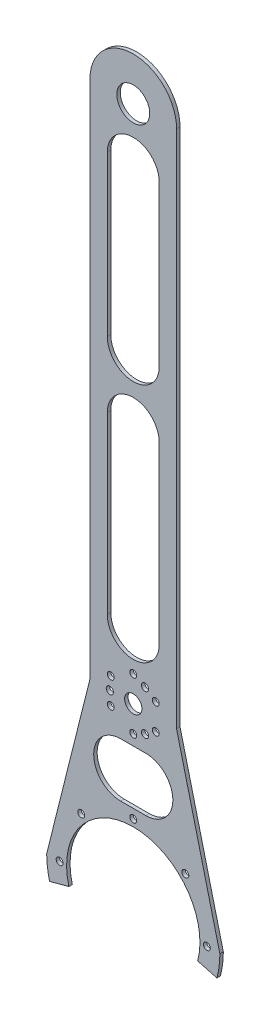
from build123d import *

# Parameters (mm, degrees)
SKETCH_1_R      = 2
SKETCH_1_R_2    = 2.08
SKETCH_1_R_3    = 5
SKETCH_1_R_4    = 9.5
EXTRUDE_1_DEPTH = 2


with BuildPart() as part:
    # 草图1 → 凸台-拉伸1 (new body)
    with BuildSketch(Plane.XY):
        with BuildLine():
            Line((37.188144312, -109.964533236), (48.296291314, -112.940952255))
            ThreePointArc((48.296291314, -112.940952255), (49.572243069, -106.526309611), (50, -100))
            Line((50, -100), (25, 0))
            Line((25, 0), (25, 300))
            ThreePointArc((25, 300), (0, 325), (-25, 300))
            Line((-25, 300), (-25, 0))
            Line((-25, 0), (-50, -100))
            ThreePointArc((-50, -100), (-49.572243069, -106.526309611), (-48.296291314, -112.940952255))
            Line((-48.296291314, -112.940952255), (-37.188144312, -109.964533236))
            ThreePointArc((-37.188144312, -109.964533236), (0, -61.5), (37.188144312, -109.964533236))
        make_face()
        with Locations((0, -15)):
            Circle(SKETCH_1_R, mode=Mode.SUBTRACT)
        with Locations((-12.990381057, -7.5)):
            Circle(SKETCH_1_R, mode=Mode.SUBTRACT)
        with Locations((-12.990381057, 7.5)):
            Circle(SKETCH_1_R, mode=Mode.SUBTRACT)
        with Locations((0, 15)):
            Circle(SKETCH_1_R, mode=Mode.SUBTRACT)
        with Locations((12.990381057, 7.5)):
            Circle(SKETCH_1_R, mode=Mode.SUBTRACT)
        with Locations((12.990381057, -7.5)):
            Circle(SKETCH_1_R, mode=Mode.SUBTRACT)
        with Locations((-13.53, 0)):
            Circle(SKETCH_1_R_2, mode=Mode.SUBTRACT)
        with Locations((6.765, 11.717323713)):
            Circle(SKETCH_1_R_2, mode=Mode.SUBTRACT)
        with Locations((6.765, -11.717323713)):
            Circle(SKETCH_1_R_2, mode=Mode.SUBTRACT)
        Circle(SKETCH_1_R_3, mode=Mode.SUBTRACT)
        with Locations((-42.5, -100)):
            Circle(SKETCH_1_R, mode=Mode.SUBTRACT)
        with Locations((-30.0520382, -69.9479618)):
            Circle(SKETCH_1_R, mode=Mode.SUBTRACT)
        with Locations((0, -57.5)):
            Circle(SKETCH_1_R, mode=Mode.SUBTRACT)
        with Locations((30.0520382, -69.9479618)):
            Circle(SKETCH_1_R, mode=Mode.SUBTRACT)
        with Locations((42.5, -100)):
            Circle(SKETCH_1_R, mode=Mode.SUBTRACT)
        with Locations((0, 300)):
            Circle(SKETCH_1_R_4, mode=Mode.SUBTRACT)
        with BuildLine():
            Line((-15, 37.231839261), (-15, 138.190211212))
            ThreePointArc((-15, 138.190211212), (0, 153.190211212), (15, 138.190211212))
            Line((15, 138.190211212), (15, 37.231839261))
            ThreePointArc((15, 37.231839261), (0, 22.231839261), (-15, 37.231839261))
        make_face(mode=Mode.SUBTRACT)
        with BuildLine():
            Line((-7.285756476, -21.115181502), (7.285756476, -21.115181502))
            ThreePointArc((7.285756476, -21.115181502), (22.853925458, -36.683350484), (7.285756476, -52.251519465))
            Line((7.285756476, -52.251519465), (-7.285756476, -52.251519465))
            ThreePointArc((-7.285756476, -52.251519465), (-22.853925458, -36.683350484), (-7.285756476, -21.115181502))
        make_face(mode=Mode.SUBTRACT)
        with BuildLine():
            Line((-15, 176.144279665), (-15, 268.287785105))
            ThreePointArc((-15, 268.287785105), (0, 283.287785105), (15, 268.287785105))
            Line((15, 268.287785105), (15, 176.144279665))
            ThreePointArc((15, 176.144279665), (0, 161.144279665), (-15, 176.144279665))
        make_face(mode=Mode.SUBTRACT)
    extrude(amount=EXTRUDE_1_DEPTH)


solid = part.part
